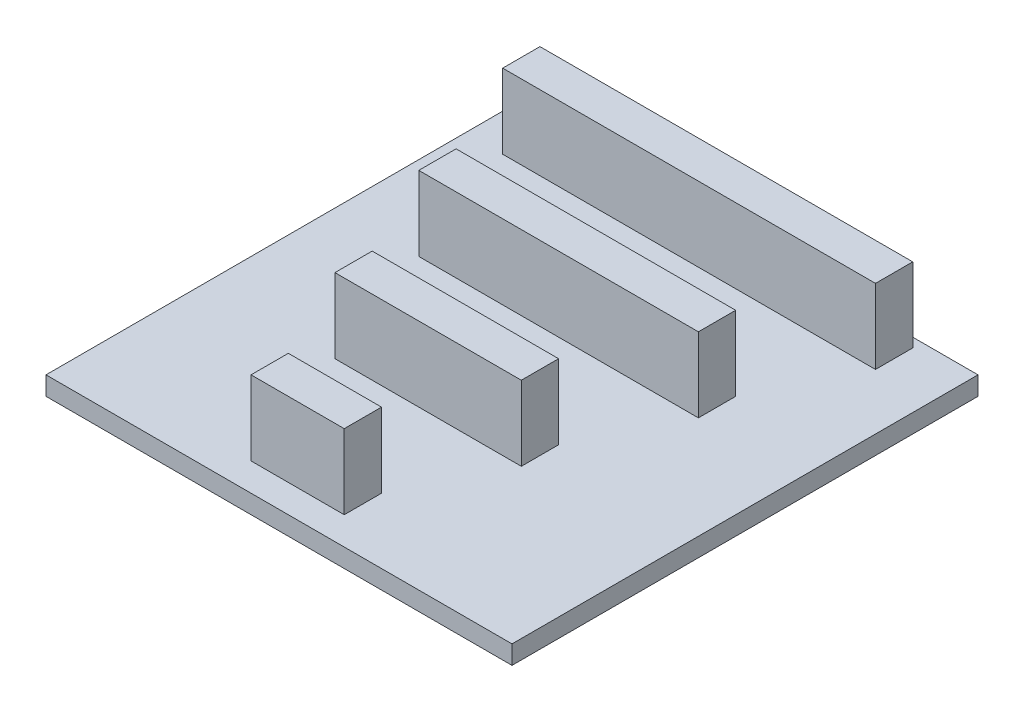
from build123d import *

# Parameters (mm, degrees)
SKETCH5_W             = 10
SKETCH5_H             = 4
BOSS_EXTRUDE4_DEPTH   = 8
SKETCH5_W_2           = 20
BOSS_EXTRUDE4_2_DEPTH = 8
SKETCH5_W_3           = 30
BOSS_EXTRUDE4_3_DEPTH = 8
SKETCH5_W_4           = 40
BOSS_EXTRUDE4_4_DEPTH = 8
SKETCH1_W             = 50
SKETCH1_H             = 50
BOSS_EXTRUDE5_DEPTH   = 2


with BuildPart() as part:
    # Sketch5 → Boss-Extrude4 (new body)
    with BuildSketch(Plane(origin=(0, 1, 0), x_dir=(1, 0, 0), z_dir=(0, 1, 0))):
        with Locations((0, -21)):
            Rectangle(SKETCH5_W, SKETCH5_H)
    extrude(amount=BOSS_EXTRUDE4_DEPTH)


with BuildPart() as body_2:
    # Sketch5 → Boss-Extrude4 2 (new body)
    with BuildSketch(Plane(origin=(0, 1, 0), x_dir=(1, 0, 0), z_dir=(0, 1, 0))):
        with Locations((0, -7)):
            Rectangle(SKETCH5_W_2, SKETCH5_H)
    extrude(amount=BOSS_EXTRUDE4_2_DEPTH)


with BuildPart() as body_3:
    # Sketch5 → Boss-Extrude4 3 (new body)
    with BuildSketch(Plane(origin=(0, 1, 0), x_dir=(1, 0, 0), z_dir=(0, 1, 0))):
        with Locations((0, 7)):
            Rectangle(SKETCH5_W_3, SKETCH5_H)
    extrude(amount=BOSS_EXTRUDE4_3_DEPTH)


with BuildPart() as body_4:
    # Sketch5 → Boss-Extrude4 4 (new body)
    with BuildSketch(Plane(origin=(0, 1, 0), x_dir=(1, 0, 0), z_dir=(0, 1, 0))):
        with Locations((0, 21)):
            Rectangle(SKETCH5_W_4, SKETCH5_H)
    extrude(amount=BOSS_EXTRUDE4_4_DEPTH)


with BuildPart() as body_5:
    # Sketch1 → Boss-Extrude5 (new body)
    with BuildSketch(Plane(origin=(0, 0, 0), x_dir=(1, 0, 0), z_dir=(0, 1, 0))):
        Rectangle(SKETCH1_W, SKETCH1_H)
    extrude(amount=-BOSS_EXTRUDE5_DEPTH)


solid = Compound([part.part, body_2.part, body_3.part, body_4.part, body_5.part])
